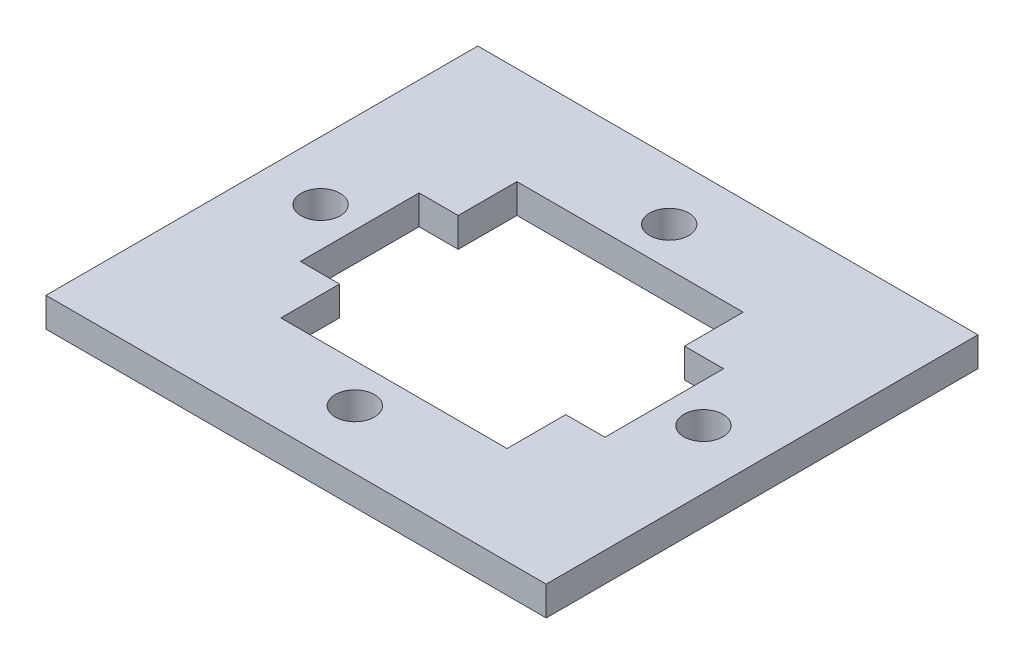
from build123d import *

# Parameters (mm, degrees)
ESBO_O1_W                = 51.12
ESBO_O1_H                = 44.13
ESBO_O1_R                = 2
RESSALTO_EXTRUS_O1_DEPTH = 3


with BuildPart() as part:
    # Esboço1 → Ressalto-extrusão1 (new body)
    with BuildSketch(Plane(origin=(0, 0, 0), x_dir=(1, 0, 0), z_dir=(0, 1, 0))):
        with Locations((11.56, 12.065)):
            Rectangle(ESBO_O1_W, ESBO_O1_H)
        with Locations(Location((31.12, 12.065, 0), (0, 0, 270))):
            Circle(ESBO_O1_R, mode=Mode.SUBTRACT)
        with Locations(Location((-8, 12.065, 0), (0, 0, 270))):
            Circle(ESBO_O1_R, mode=Mode.SUBTRACT)
        with Locations(Location((11.56, 28.13, 0), (0, 0, 270))):
            Circle(ESBO_O1_R, mode=Mode.SUBTRACT)
        with Locations(Location((11.56, -4, 0), (0, 0, 270))):
            Circle(ESBO_O1_R, mode=Mode.SUBTRACT)
        Polygon((23.12, 24.13), (23.12, 18.13), (27.12, 18.13), (27.12, 6), (23.12, 6), (23.12, 0), (0, 0), (0, 6), (-4, 6), (-4, 18.13), (0, 18.13), (0, 24.13), align=None, mode=Mode.SUBTRACT)
    extrude(amount=RESSALTO_EXTRUS_O1_DEPTH)


solid = part.part
